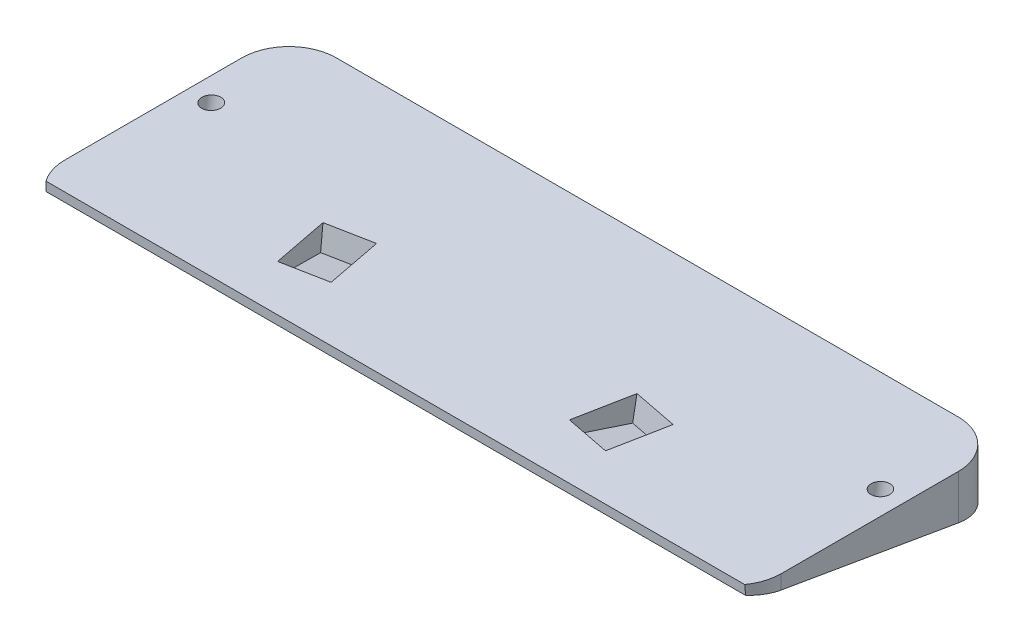
from build123d import *

# Parameters (mm, degrees)
EXTRUDE_2_DEPTH          = 91
FILLET_2_R               = 6
CUT_EXTRUDE_3_DEPTH      = 2.9
CUT_EXTRUDE_3_DEPTH_BACK = 2.9
CUT_EXTRUDE_4_DEPTH      = 2.9
CUT_EXTRUDE_4_DEPTH_BACK = 2.9
CUT_EXTRUDE_5_REACH      = 96.666
SKETCH_17_R              = 1.186185632
SKETCH_17_R_2            = 1.2
CHAMFER_1_SIZE           = 1.2
CUT_EXTRUDE_6_DEPTH      = 91
CUT_EXTRUDE_7_DEPTH      = 96.001094263
CUT_EXTRUDE_7_DEPTH_BACK = 96.001094263


with BuildPart() as part:
    # Эскиз2 → Бобышка-Вытянуть2 (new body)
    with BuildSketch(Plane(origin=(0, 0, 0), x_dir=(0, 0, -1), z_dir=(1, 0, 0))):
        Polygon((-26.444619702, 0), (5.555380298, 0), (5.584037691, -6.7), (-26.444619702, -1.2), align=None)
    extrude(amount=EXTRUDE_2_DEPTH)

    # Скругление2
    fillet_2_edges = [part.edges().sort_by_distance(p)[0] for p in [
        (91, -3.35, -5.569708994),
        (0, -3.35, -5.569708994),
    ]]
    fillet(fillet_2_edges, radius=FILLET_2_R)

    # Эскиз7 → Вырез-Вытянуть3 (cut, two sides: drawn at the far end of the back side and taken through both)
    with BuildSketch(Plane(origin=(22.76798721, 0, -4.425648392), x_dir=(0, -1, 0), z_dir=(0.9816271834476652, 0, -0.19080899537653845)).offset(-CUT_EXTRUDE_3_DEPTH_BACK)):
        Polygon((0, -17.611696981), (0, -24.901696981), (1.7, -25.042701632), (3.07611105, -17.995807395), align=None)
    extrude(amount=CUT_EXTRUDE_3_DEPTH + CUT_EXTRUDE_3_DEPTH_BACK, mode=Mode.SUBTRACT)

    # Эскиз16 → Вырез-Вытянуть4 (cut, two sides: drawn at the far end of the back side and taken through both)
    with BuildSketch(Plane(origin=(64.918878173, 0, 12.618951608), x_dir=(0, -1, 0), z_dir=(-0.9816271834476652, 0, -0.19080899537653845)).offset(-CUT_EXTRUDE_4_DEPTH_BACK)):
        Polygon((0, 0.219393943), (3.063590709, 0.693115345), (1.688216377, 7.740153407), (0, 7.540339831), align=None)
    extrude(amount=CUT_EXTRUDE_4_DEPTH + CUT_EXTRUDE_4_DEPTH_BACK, mode=Mode.SUBTRACT)

    # Вырез-Вытянуть5: up to this plane
    cut_extrude_5_end = Plane(origin=(91, 0, 26.444619702), z_dir=(0, -1, 0))
    # Эскиз17 → Вырез-Вытянуть5 (cut, up to the surface)
    with BuildSketch(Plane(origin=(0, -5.576656818, 0.957630291), x_dir=(1, 0, 0), z_dir=(0, -0.9855741825905647, 0.16924399726708236)), mode=Mode.PRIVATE) as cut_extrude_5_sk1:
        with Locations(Location((88, 7.222581836, 0), (0, 0, 270))):
            Circle(SKETCH_17_R)
    cut_extrude_5_tool1 = split(extrude(cut_extrude_5_sk1.sketch, amount=-CUT_EXTRUDE_5_REACH, mode=Mode.PRIVATE), bisect_by=cut_extrude_5_end, keep=Keep.BOTH, mode=Mode.PRIVATE)
    add(cut_extrude_5_tool1.solids().sort_by_distance((88, -4.354278, 8.07602))[0], mode=Mode.SUBTRACT)
    # Эскиз17 → Вырез-Вытянуть5 (cut, up to the surface)
    with BuildSketch(Plane(origin=(0, -5.576656818, 0.957630291), x_dir=(1, 0, 0), z_dir=(0, -0.9855741825905647, 0.16924399726708236)), mode=Mode.PRIVATE) as cut_extrude_5_sk2:
        with Locations(Location((3, 7.222581836, 0), (0, 0, 270))):
            Circle(SKETCH_17_R_2)
    cut_extrude_5_tool2 = split(extrude(cut_extrude_5_sk2.sketch, amount=-CUT_EXTRUDE_5_REACH, mode=Mode.PRIVATE), bisect_by=cut_extrude_5_end, keep=Keep.BOTH, mode=Mode.PRIVATE)
    add(cut_extrude_5_tool2.solids().sort_by_distance((3, -4.354278, 8.07602))[0], mode=Mode.SUBTRACT)

    # Фаска1
    chamfer_1_edges = [part.edges().sort_by_distance(p)[0] for p in [
        (88, -4.1535234, 9.245094415),
        (3, -4.151185401, 9.258709499),
    ]]
    chamfer(chamfer_1_edges, length=CHAMFER_1_SIZE)

    # Эскиз21 → Вырез-Вытянуть6 (cut)
    with BuildSketch(Plane(origin=(91, 0, 0), x_dir=(0, 0, -1), z_dir=(1, 0, 0))):
        Polygon((-26.444619702, 0), (-26.377093105, -1.211595749), (-26.444619702, -1.2), align=None)
    extrude(amount=-CUT_EXTRUDE_6_DEPTH, mode=Mode.SUBTRACT)

    # Эскиз22 → Вырез-Вытянуть7 (cut, two sides: drawn at the far end of the back side and taken through both)
    with BuildSketch(Plane(origin=(0, 0, 0), x_dir=(1, 0, 0), z_dir=(0, 1, 0)).offset(-CUT_EXTRUDE_7_DEPTH_BACK)):
        with BuildLine():
            ThreePointArc((1.126602828, -26.444619702), (0.288591109, -24.783045247), (0, -22.944619702))
            Line((0, -22.944619702), (0, -26.444619702))
            Line((0, -26.444619702), (1.126602828, -26.444619702))
        make_face()
        with BuildLine():
            ThreePointArc((90.999774909, -22.944972896), (90.711129698, -24.783213348), (89.873172092, -26.444619702))
            Line((89.873172092, -26.444619702), (91, -26.444619702))
            Line((91, -26.444619702), (91, -19.121160447))
            Line((91, -19.121160447), (90.999774909, -22.944972896))
        make_face()
    extrude(amount=CUT_EXTRUDE_7_DEPTH + CUT_EXTRUDE_7_DEPTH_BACK, mode=Mode.SUBTRACT)


solid = part.part
